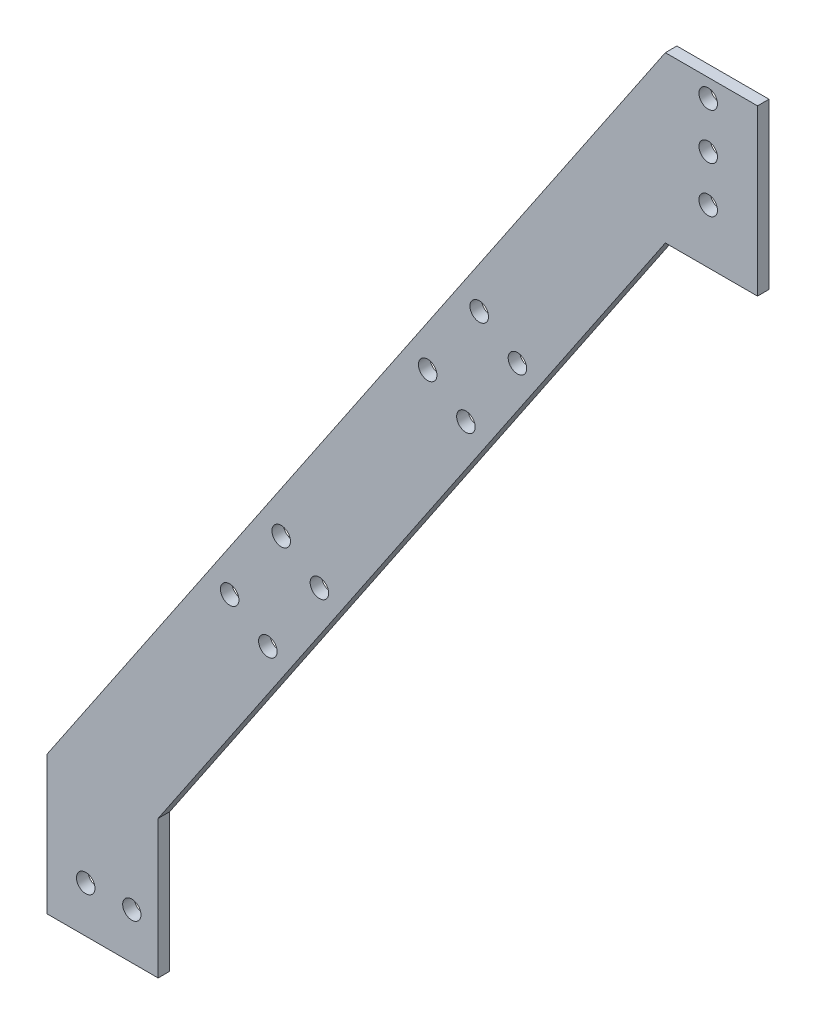
from build123d import *

# Parameters (mm, degrees)
BOSS_EXTRUDE1_DEPTH = 3.175
SKETCH2_R           = 2.5527
SKETCH2_R_2         = 2.522358926
CUT_EXTRUDE1_DEPTH  = 351.604295129
SKETCH3_R           = 2.5527
CUT_EXTRUDE2_DEPTH  = 351.604295129


with BuildPart() as part:
    # Sketch1 → Boss-Extrude1 (new body)
    with BuildSketch(Plane.XY):
        Polygon((0, 0), (0, 38.1), (170.441996978, 290.790652115), (195.841996978, 290.790652115), (195.841996978, 245.368044206), (170.441996978, 245.368044206), (30.637935892, 38.1), (30.637935892, 0), align=None)
    extrude(amount=BOSS_EXTRUDE1_DEPTH)

    # Sketch2 → Cut-Extrude1 (cut, through all)
    with BuildSketch(Plane.XY.offset(3.175)):
        with Locations((182.257063518, 285.750000017)):
            Circle(SKETCH2_R)
        with Locations((182.257063518, 273.050000017)):
            Circle(SKETCH2_R)
        with Locations((23.380063476, 12.7)):
            Circle(SKETCH2_R_2)
        with Locations((10.680063476, 12.7)):
            Circle(SKETCH2_R)
        with Locations((182.257063518, 260.350000017)):
            Circle(SKETCH2_R)
    extrude(amount=-CUT_EXTRUDE1_DEPTH, mode=Mode.SUBTRACT)

    # Sketch3 → Cut-Extrude2 (cut, through all)
    with BuildSketch(Plane.XY.offset(3.175)):
        with Locations((104.936582102, 182.319228816)):
            Circle(SKETCH3_R)
        with Locations((129.668859022, 196.275033285)):
            Circle(SKETCH3_R)
        with Locations((119.14008185, 203.376783159)):
            Circle(SKETCH3_R)
        with Locations((115.465359274, 175.217478942)):
            Circle(SKETCH3_R)
        with Locations((50.353519505, 101.396510668)):
            Circle(SKETCH3_R)
        with Locations((64.557019253, 122.454065011)):
            Circle(SKETCH3_R)
        with Locations((75.085796425, 115.352315137)):
            Circle(SKETCH3_R)
        with Locations((60.882296677, 94.294760794)):
            Circle(SKETCH3_R)
    extrude(amount=-CUT_EXTRUDE2_DEPTH, mode=Mode.SUBTRACT)


solid = part.part
